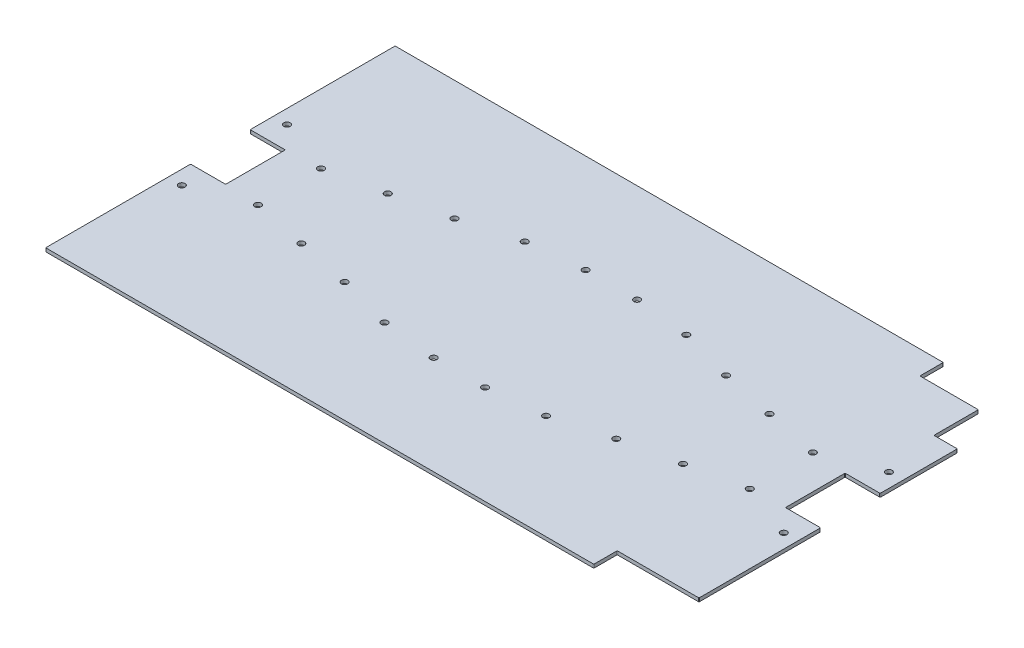
from build123d import *

# Parameters (mm, degrees)
SKETCH1_W                  = 539
SKETCH1_H                  = 299
BOSS_EXTRUDE1_DEPTH        = 3
SKETCH5_W                  = 70
SKETCH5_H                  = 20
CUT_EXTRUDE2_DEPTH         = 309.203666429
SKETCH2_W                  = 30
SKETCH2_H                  = 51
CUT_EXTRUDE1_DEPTH         = 309.203666429
F_5_5_5_5_DIAMETER_HOLE1_D = 5.5
MIRROR3_COPY_1_D           = 5.5
FILLET1_R                  = 0.5


with BuildPart() as part:
    # Sketch1 → Boss-Extrude1 (new body)
    with BuildSketch(Plane(origin=(0, 0, 0), x_dir=(1, 0, 0), z_dir=(0, 1, 0))):
        Rectangle(SKETCH1_W, SKETCH1_H)
    extrude(amount=BOSS_EXTRUDE1_DEPTH)

    # Sketch5 → Cut-Extrude2 (cut, through all)
    with BuildSketch(Plane(origin=(0, 3, 0), x_dir=(1, 0, 0), z_dir=(0, 1, 0))):
        Polygon((269.5, 149.5), (199.5, 149.5), (199.5, 129.5), (249.5, 129.5), (249.5, 91.5), (269.5, 91.5), align=None)
        with Locations((234.5, -139.5)):
            Rectangle(SKETCH5_W, SKETCH5_H)
    extrude(amount=-CUT_EXTRUDE2_DEPTH, mode=Mode.SUBTRACT)

    # Sketch2 → Cut-Extrude1 (cut, through all)
    with BuildSketch(Plane(origin=(0, 3, 0), x_dir=(1, 0, 0), z_dir=(0, 1, 0))):
        with Locations((-254.5, 0)):
            Rectangle(SKETCH2_W, SKETCH2_H)
    cut_extrude1 = extrude(amount=-CUT_EXTRUDE1_DEPTH, mode=Mode.SUBTRACT)

    # Mirror1: Cut-Extrude1 across plane
    add(cut_extrude1.mirror(Plane(origin=(0, 0, 0), x_dir=(0, 0, 1), z_dir=(1, 0, 0))), mode=Mode.SUBTRACT)

    # Ø5.5 (5.5) Diameter Hole1 (through all)
    with Locations(Plane(origin=(-257.5, 3, 45), x_dir=(0, 0, 1), z_dir=(0, 1, 0))):
        with Locations((0, 0), (-18.019432511, 47.1), (-8.008018456, 94.2), (2.003395598, 141.3), (15, 188.4), (20, 235.5)):
            f_5_5_5_5_diameter_hole1 = Hole(F_5_5_5_5_DIAMETER_HOLE1_D / 2)

    # Mirror2: Ø5.5 (5.5) Diameter Hole1 across plane
    add(f_5_5_5_5_diameter_hole1.mirror(Plane(origin=(0, 0, 0), x_dir=(0, 0, 1), z_dir=(1, 0, 0))), mode=Mode.SUBTRACT)

    # Mirror3: Ø5.5 (5.5) Diameter Hole1 across plane
    add(f_5_5_5_5_diameter_hole1.mirror(Plane.XY), mode=Mode.SUBTRACT)

    # Mirror3 copy 1 (through all)
    with Locations(Plane(origin=(257.5, 3, -45), x_dir=(0, 0, -1), z_dir=(0, 1, 0))):
        with Locations((0, 0), (-18.019432511, 47.1), (-8.008018456, 94.2), (2.003395598, 141.3), (15, 188.4), (20, 235.5)):
            Hole(MIRROR3_COPY_1_D / 2)

    # Fillet1
    fillet1_edges = [part.edges().sort_by_distance(p)[0] for p in [
        (269.5, 1.5, -91.5),
        (249.5, 1.5, -91.5),
        (249.5, 1.5, -129.5),
        (199.5, 1.5, -129.5),
        (199.5, 1.5, -149.5),
        (269.5, 1.5, 129.5),
        (199.5, 1.5, 149.5),
        (199.5, 1.5, 129.5),
        (-269.5, 1.5, 25.5),
        (-269.5, 1.5, -25.5),
        (-239.5, 1.5, -25.5),
        (-239.5, 1.5, 25.5),
        (269.5, 1.5, -25.5),
        (269.5, 1.5, 25.5),
        (239.5, 1.5, 25.5),
        (239.5, 1.5, -25.5),
        (-269.5, 1.5, -149.5),
        (-269.5, 1.5, 149.5),
    ]]
    fillet(fillet1_edges, radius=FILLET1_R)


solid = part.part
